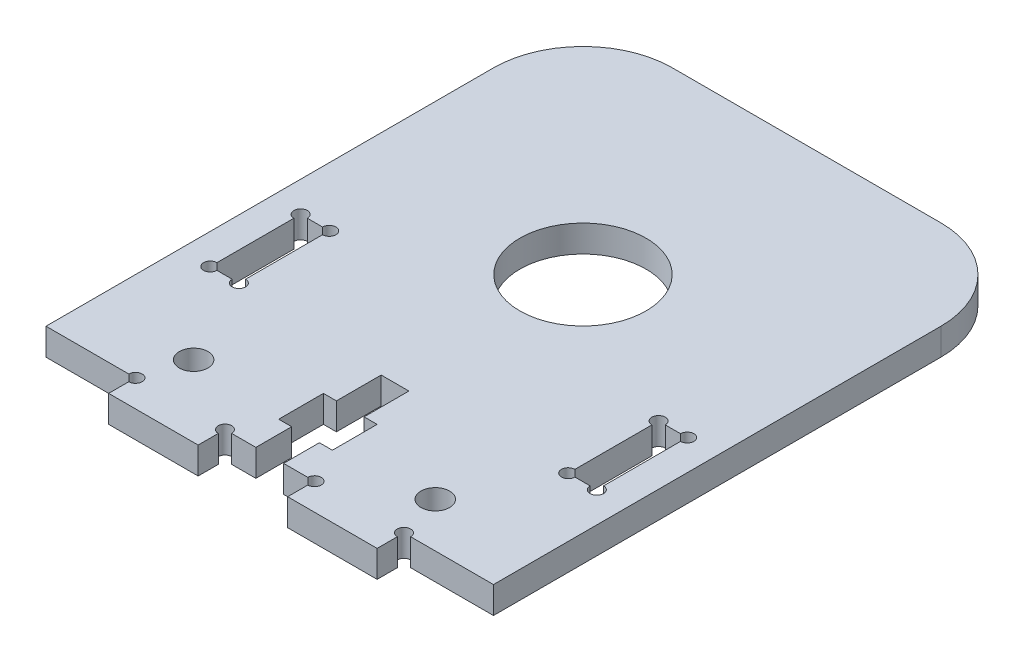
from build123d import *

# Parameters (mm, degrees)
SKETCH_1_W          = 50
SKETCH_1_H          = 60
EXTRUDE_1_DEPTH     = 3
SKETCH_2_W          = 10
SKETCH_2_H          = 3
EXTRUDE_2_DEPTH     = 3
CUT_EXTRUDE_1_DEPTH = 42.509035161
SKETCH_4_R          = 7.05
CUT_EXTRUDE_2_DEPTH = 42.509035161
SKETCH_5_R          = 1.6
SKETCH_5_W          = 3.2
SKETCH_5_H          = 10.1
CUT_EXTRUDE_3_DEPTH = 42.509035161
SKETCH_7_R          = 0.75
CUT_EXTRUDE_4_DEPTH = 42.509035161
FILLET_1_R          = 10


with BuildPart() as part:
    # 草图1 → 凸台-拉伸1 (new body)
    with BuildSketch(Plane(origin=(0, 0, 0), x_dir=(1, 0, 0), z_dir=(0, 1, 0))):
        Rectangle(SKETCH_1_W, SKETCH_1_H)
    extrude(amount=EXTRUDE_1_DEPTH)

    # 草图2 → 凸台-拉伸2 (add)
    with BuildSketch(Plane(origin=(0, 3, 0), x_dir=(1, 0, 0), z_dir=(0, 1, 0))):
        with Locations((-10, -31.5)):
            Rectangle(SKETCH_2_W, SKETCH_2_H)
        with Locations((10, -31.5)):
            Rectangle(SKETCH_2_W, SKETCH_2_H)
    extrude(amount=-EXTRUDE_2_DEPTH)

    # 草图3 → 切除-拉伸1 (cut, through all)
    with BuildSketch(Plane(origin=(0, 3, 0), x_dir=(1, 0, 0), z_dir=(0, 1, 0))):
        Polygon((-1.55, -30), (-1.55, -26), (-3, -26), (-3, -21), (-1.55, -21), (-1.55, -16), (1.55, -16), (1.55, -21), (3, -21), (3, -26), (1.55, -26), (1.55, -30), align=None)
    extrude(amount=-CUT_EXTRUDE_1_DEPTH, mode=Mode.SUBTRACT)

    # 草图4 → 切除-拉伸2 (cut, through all)
    with BuildSketch(Plane(origin=(0, 3, 0), x_dir=(1, 0, 0), z_dir=(0, 1, 0))):
        with Locations(Location((0, 5, 0), (0, 0, 270))):
            Circle(SKETCH_4_R)
    extrude(amount=-CUT_EXTRUDE_2_DEPTH, mode=Mode.SUBTRACT)

    # 草图5 → 切除-拉伸3 (cut, through all)
    with BuildSketch(Plane.XZ):
        with Locations(Location((13.5, 25, 0), (0, 0, 270))):
            Circle(SKETCH_5_R)
        with Locations(Location((-13.5, 25, 0), (0, 0, 90))):
            Circle(SKETCH_5_R)
        with Locations((20, 10)):
            Rectangle(SKETCH_5_W, SKETCH_5_H)
        with Locations((-20, 10)):
            Rectangle(SKETCH_5_W, SKETCH_5_H)
    extrude(amount=-CUT_EXTRUDE_3_DEPTH, mode=Mode.SUBTRACT)

    # 草图7 → 切除-拉伸4 (cut, through all)
    with BuildSketch(Plane.XZ):
        with Locations((-21.6, 15.05)):
            Circle(SKETCH_7_R)
        with Locations((-18.4, 15.05)):
            Circle(SKETCH_7_R)
        with Locations((-18.4, 4.95)):
            Circle(SKETCH_7_R)
        with Locations((-21.6, 4.95)):
            Circle(SKETCH_7_R)
        with Locations((21.6, 4.95)):
            Circle(SKETCH_7_R)
        with Locations((18.4, 4.95)):
            Circle(SKETCH_7_R)
        with Locations((18.4, 15.05)):
            Circle(SKETCH_7_R)
        with Locations((21.6, 15.05)):
            Circle(SKETCH_7_R)
        with Locations((-15, 30)):
            Circle(SKETCH_7_R)
        with Locations((-5, 30)):
            Circle(SKETCH_7_R)
        with Locations((5, 30)):
            Circle(SKETCH_7_R)
        with Locations((15, 30)):
            Circle(SKETCH_7_R)
    extrude(amount=-CUT_EXTRUDE_4_DEPTH, mode=Mode.SUBTRACT)

    # 圆角1
    fillet_1_edges = [part.edges().sort_by_distance(p)[0] for p in [
        (-25, 1.5, -30),
        (25, 1.5, -30),
    ]]
    fillet(fillet_1_edges, radius=FILLET_1_R)


solid = part.part
